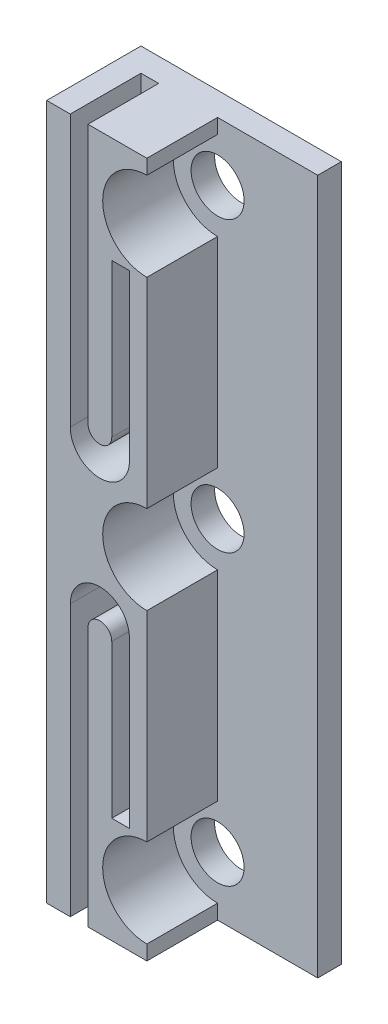
from build123d import *

# Parameters (mm, degrees)
ESQUISSE1_W             = 17
ESQUISSE1_H             = 59
BOSS_EXTRU_1_DEPTH      = 2
ESQUISSE2_W             = 8.5
ESQUISSE2_H             = 59
BOSS_EXTRU_2_DEPTH      = 6
ENL_V_MAT_EXTRU_1_DEPTH = 6
ESQUISSE4_R             = 2.25
ENL_V_MAT_EXTRU_4_DEPTH = 22
ESQUISSE6_R             = 3.75
ENL_V_MAT_EXTRU_5_DEPTH = 6


with BuildPart() as part:
    # Esquisse1 → Boss.-Extru.1 (new body)
    with BuildSketch(Plane.XY):
        with Locations((8.5, -29.5)):
            Rectangle(ESQUISSE1_W, ESQUISSE1_H)
    extrude(amount=BOSS_EXTRU_1_DEPTH)

    # Esquisse2 → Boss.-Extru.2 (add)
    with BuildSketch(Plane.XY.offset(2)):
        with Locations((4.25, -29.5)):
            Rectangle(ESQUISSE2_W, ESQUISSE2_H)
    extrude(amount=BOSS_EXTRU_2_DEPTH)

    # Esquisse3 → Enlèv. mat.-Extru.1 (cut)
    with BuildSketch(Plane.XY.offset(8)):
        Polygon((5.519925502, -9), (5.519925502, -22), (5.519925502, -23), (7.019925502, -23), (7.019925502, -9), align=None)
        with BuildLine():
            Line((3.5, -23), (2, -23))
            ThreePointArc((2, -23), (2.408191843, -24.372032093), (3.5, -25.297800743))
            Line((3.5, -25.297800743), (3.5, -23))
        make_face()
        with BuildLine():
            Line((5.519925502, -23), (5.519925502, -25.297800743))
            ThreePointArc((5.519925502, -25.297800743), (6.611733659, -24.372032093), (7.019925502, -23))
            Line((7.019925502, -23), (5.519925502, -23))
        make_face()
        Polygon((5.519925502, -36), (5.519925502, -37), (5.519925502, -50), (7.019925502, -50), (7.019925502, -36), align=None)
        Polygon((2, -36), (2, -59), (3.5, -59), (3.5, -37), (3.5, -36), align=None)
        with BuildLine():
            Line((3.5, -33.702199257), (3.5, -36))
            Line((3.5, -36), (4.368453888, -36))
            ThreePointArc((4.368453888, -36), (4.509962751, -35.990037249), (4.651471614, -36))
            Line((4.651471614, -36), (5.519925502, -36))
            Line((5.519925502, -36), (5.519925502, -33.702199257))
            ThreePointArc((5.519925502, -33.702199257), (4.509962751, -33.490037249), (3.5, -33.702199257))
        make_face()
        with BuildLine():
            ThreePointArc((3.5, -33.702199257), (2.408191843, -34.627967907), (2, -36))
            Line((2, -36), (3.5, -36))
            Line((3.5, -36), (3.5, -33.702199257))
        make_face()
        with BuildLine():
            ThreePointArc((7.019925502, -36), (6.611733659, -34.627967907), (5.519925502, -33.702199257))
            Line((5.519925502, -33.702199257), (5.519925502, -36))
            Line((5.519925502, -36), (7.019925502, -36))
        make_face()
        with BuildLine():
            Line((4.368453888, -23), (3.5, -23))
            Line((3.5, -23), (3.5, -25.297800743))
            ThreePointArc((3.5, -25.297800743), (4.509962751, -25.509962751), (5.519925502, -25.297800743))
            Line((5.519925502, -25.297800743), (5.519925502, -23))
            Line((5.519925502, -23), (4.651471614, -23))
            ThreePointArc((4.651471614, -23), (4.509962751, -23.009962751), (4.368453888, -23))
        make_face()
        Polygon((2, 0), (2, -23), (3.5, -23), (3.5, -22), (3.5, 0), align=None)
        with BuildLine():
            Line((3.5, -22), (3.5, -23))
            Line((3.5, -23), (4.368453888, -23))
            ThreePointArc((4.368453888, -23), (3.747419821, -22.662233372), (3.5, -22))
        make_face()
        with BuildLine():
            Line((5.519925502, -23), (5.519925502, -22))
            ThreePointArc((5.519925502, -22), (5.272505681, -22.662233372), (4.651471614, -23))
            Line((4.651471614, -23), (5.519925502, -23))
        make_face()
        with BuildLine():
            Line((3.5, -36), (3.5, -37))
            ThreePointArc((3.5, -37), (3.747419821, -36.337766628), (4.368453888, -36))
            Line((4.368453888, -36), (3.5, -36))
        make_face()
        with BuildLine():
            ThreePointArc((4.651471614, -36), (5.272505681, -36.337766628), (5.519925502, -37))
            Line((5.519925502, -37), (5.519925502, -36))
            Line((5.519925502, -36), (4.651471614, -36))
        make_face()
    extrude(amount=-ENL_V_MAT_EXTRU_1_DEPTH, mode=Mode.SUBTRACT)

    # Esquisse4 → Enlèv. mat.-Extru.4 (cut)
    with BuildSketch(Plane.XY.offset(8)):
        with Locations((8.5, -29.5)):
            Circle(ESQUISSE4_R)
        with Locations((8.5, -54)):
            Circle(ESQUISSE4_R)
        with Locations((8.5, -5)):
            Circle(ESQUISSE4_R)
    extrude(amount=-ENL_V_MAT_EXTRU_4_DEPTH, mode=Mode.SUBTRACT)

    # Esquisse6 → Enlèv. mat.-Extru.5 (cut)
    with BuildSketch(Plane.XY.offset(8)):
        with Locations((8.5, -29.5)):
            Circle(ESQUISSE6_R)
        with Locations((8.5, -5)):
            Circle(ESQUISSE6_R)
        with Locations((8.5, -54)):
            Circle(ESQUISSE6_R)
    extrude(amount=-ENL_V_MAT_EXTRU_5_DEPTH, mode=Mode.SUBTRACT)


solid = part.part
